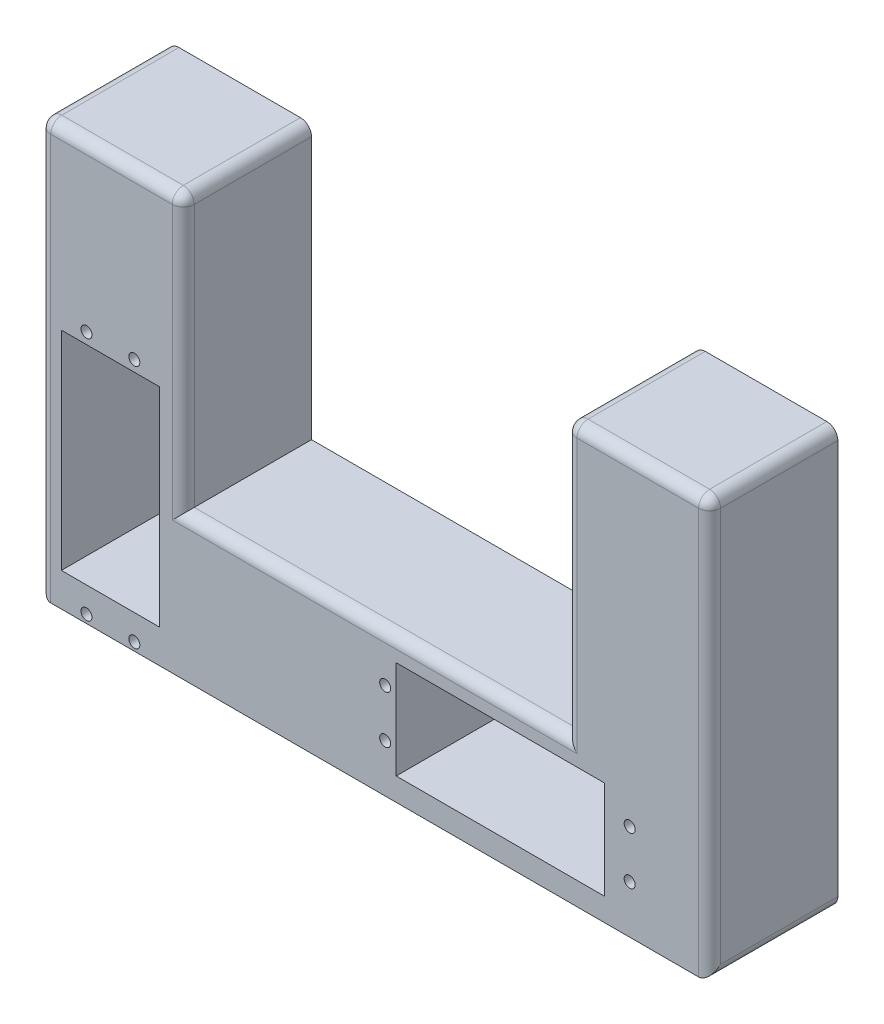
from build123d import *

# Parameters (mm, degrees)
BOSS_EXTRUDE1_DEPTH = 26.8
SKETCH2_W           = 20.5
SKETCH2_H           = 43.5
SKETCH2_W_2         = 43.5
SKETCH2_H_2         = 20.5
CUT_EXTRUDE1_DEPTH  = 157.194070808
SKETCH3_R           = 1.15
BOSS_EXTRUDE2_DEPTH = 26.8
SKETCH3_2_R         = 1.15
CUT_EXTRUDE2_DEPTH  = 157.194070808
SKETCH4_R           = 1.15
CUT_EXTRUDE3_DEPTH  = 157.194070808
FILLET1_R           = 2.3


with BuildPart() as part:
    # Sketch1 → Boss-Extrude1 (new body)
    with BuildSketch(Plane.XY):
        Polygon((86.954468728, 12.865007186), (116.954468728, 12.865007186), (116.954468728, 100), (86.954468728, 100), (86.954468728, 42.865007186), (6.954468728, 42.865007186), (6.954468728, 100), (-23.045531272, 100), (-23.045531272, 12.865007186), (6.954468728, 12.865007186), align=None)
    extrude(amount=BOSS_EXTRUDE1_DEPTH)

    # Sketch2 → Cut-Extrude1 (cut, through all)
    with BuildSketch(Plane.XY.offset(26.8)):
        with Locations((-8.275140501, 41.615007186)):
            Rectangle(SKETCH2_W, SKETCH2_H)
        with Locations((73.204468728, 27.895224973)):
            Rectangle(SKETCH2_W_2, SKETCH2_H_2)
    extrude(amount=-CUT_EXTRUDE1_DEPTH, mode=Mode.SUBTRACT)

    # Sketch3 → Boss-Extrude2 (add, through all)
    with BuildSketch(Plane.XY.offset(26.8)):
        with Locations((-13.275140501, 14.565007186)):
            Circle(SKETCH3_R)
        with Locations((-3.275140501, 14.565007186)):
            Circle(SKETCH3_R)
        with Locations((-13.275140501, 65.665007186)):
            Circle(SKETCH3_R)
        with Locations((-3.275140501, 65.665007186)):
            Circle(SKETCH3_R)
    extrude(amount=-BOSS_EXTRUDE2_DEPTH)

    # Sketch3<2> → Cut-Extrude2 (cut, through all)
    with BuildSketch(Plane.XY.offset(26.8)):
        with Locations((-13.275140501, 14.565007186)):
            Circle(SKETCH3_2_R)
        with Locations((-3.275140501, 14.565007186)):
            Circle(SKETCH3_2_R)
        with Locations((-13.275140501, 65.665007186)):
            Circle(SKETCH3_2_R)
        with Locations(Location((-3.275140501, 65.665007186, 0), (0, 0, 180))):
            Circle(SKETCH3_2_R)
    extrude(amount=-CUT_EXTRUDE2_DEPTH, mode=Mode.SUBTRACT)

    # Sketch4 → Cut-Extrude3 (cut, through all)
    with BuildSketch(Plane.XY.offset(26.8)):
        with Locations((100.254468728, 22.895224973)):
            Circle(SKETCH4_R)
        with Locations(Location((100.254468728, 32.895224973, 0), (0, 0, 180))):
            Circle(SKETCH4_R)
        with Locations((49.154468728, 22.895224973)):
            Circle(SKETCH4_R)
        with Locations(Location((49.154468728, 32.895224973, 0), (0, 0, 180))):
            Circle(SKETCH4_R)
    extrude(amount=-CUT_EXTRUDE3_DEPTH, mode=Mode.SUBTRACT)

    # Fillet1
    fillet1_edges = [part.edges().sort_by_distance(p)[0] for p in [
        (6.954468728, 100, 13.4),
        (86.954468728, 100, 13.4),
        (116.954468728, 100, 13.4),
        (116.954468728, 12.865007186, 13.4),
        (-23.045531272, 12.865007186, 13.4),
        (-23.045531272, 100, 13.4),
        (116.954468728, 56.432503593, 26.8),
        (101.954468728, 100, 26.8),
        (86.954468728, 71.432503593, 26.8),
        (46.954468728, 42.865007186, 26.8),
        (6.954468728, 71.432503593, 26.8),
        (-8.045531272, 100, 26.8),
        (-23.045531272, 56.432503593, 26.8),
    ]]
    fillet(fillet1_edges, radius=FILLET1_R)


solid = part.part
